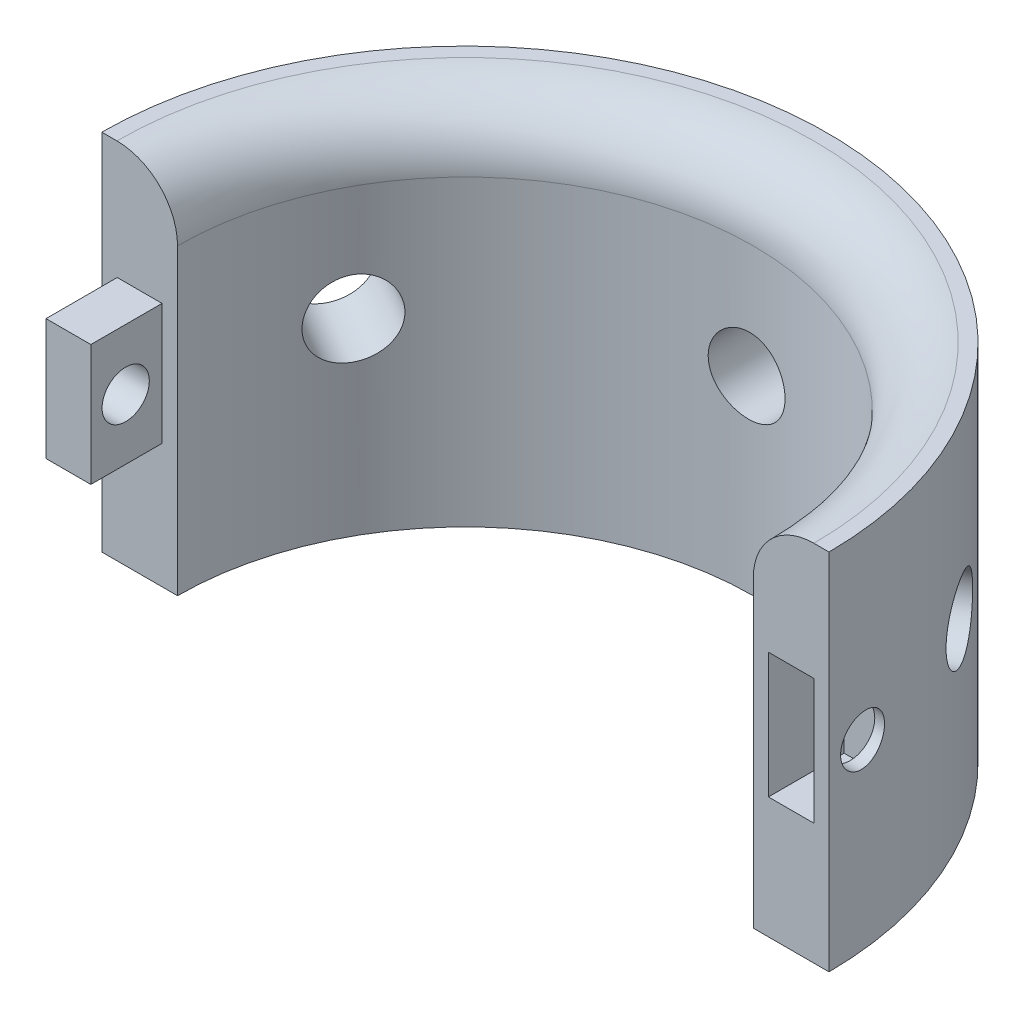
from build123d import *

# Parameters (mm, degrees)
BOSS_EXTRUDE1_DEPTH = 30.48
SKETCH3_R           = 24.13
CUT_EXTRUDE4_DEPTH  = 90.914560616
SKETCH4_R           = 3.175
CUT_EXTRUDE5_DEPTH  = 63.754
CIRPATTERN3_COUNT   = 6
SKETCH6_W           = 3.81
SKETCH6_H           = 10.509433013
CUT_EXTRUDE6_DEPTH  = 6.35
SKETCH7_W           = 3.7592
SKETCH7_H           = 10.16
BOSS_EXTRUDE4_DEPTH = 5.969
SKETCH8_R           = 1.980775352
CUT_EXTRUDE7_DEPTH  = 5.969
SKETCH9_R           = 2.056796453
CUT_EXTRUDE8_DEPTH  = 12.319
FILLET4_R           = 5.08


with BuildPart() as part:
    # Sketch1 → Boss-Extrude1 (new body)
    with BuildSketch(Plane(origin=(0, 0, 0), x_dir=(1, 0, 0), z_dir=(0, 1, 0))):
        with BuildLine():
            Line((-78.958715675, 0), (-17.998715675, 0))
            ThreePointArc((-17.998715675, 0), (-48.478715675, 30.349942827), (-78.958715675, 0))
        make_face()
    extrude(amount=BOSS_EXTRUDE1_DEPTH)

    # Sketch3 → Cut-Extrude4 (cut, through all)
    with BuildSketch(Plane(origin=(0, 0, 0), x_dir=(1, 0, 0), z_dir=(0, 1, 0))):
        with Locations((-48.478715675, 0)):
            Circle(SKETCH3_R)
    extrude(amount=CUT_EXTRUDE4_DEPTH, mode=Mode.SUBTRACT)

    # Sketch4 → Cut-Extrude5 (cut)
    with BuildSketch(Plane.XY):
        with Locations((-48.824364134, 15.798935299)):
            Circle(SKETCH4_R)
    cut_extrude5 = extrude(amount=-CUT_EXTRUDE5_DEPTH, mode=Mode.SUBTRACT)

    # CirPattern3: Cut-Extrude5 ×6 about axis
    cirpattern3_axis = Axis((-48.478715675, 30.48, 0.130335837), (0, -1, 0))
    for i in range(1, CIRPATTERN3_COUNT):
        add(cut_extrude5.rotate(cirpattern3_axis, i * 360 / CIRPATTERN3_COUNT), mode=Mode.SUBTRACT)

    # Sketch6 → Cut-Extrude6 (cut)
    with BuildSketch(Plane.XY):
        with Locations((-21.173715675, 15.414716507)):
            Rectangle(SKETCH6_W, SKETCH6_H)
    extrude(amount=-CUT_EXTRUDE6_DEPTH, mode=Mode.SUBTRACT)

    # Sketch7 → Boss-Extrude4 (add)
    with BuildSketch(Plane.XY):
        with Locations((-75.783715675, 15.494)):
            Rectangle(SKETCH7_W, SKETCH7_H)
    extrude(amount=BOSS_EXTRUDE4_DEPTH)

    # Sketch8 → Cut-Extrude7 (cut)
    with BuildSketch(Plane(origin=(-73.904115675, 0, 0), x_dir=(0, 0, -1), z_dir=(1, 0, 0))):
        with Locations((-3.048, 15.494)):
            Circle(SKETCH8_R)
    extrude(amount=-CUT_EXTRUDE7_DEPTH, mode=Mode.SUBTRACT)

    # Sketch9 → Cut-Extrude8 (cut)
    with BuildSketch(Plane(origin=(-23.078715675, 0, 0), x_dir=(0, 0, -1), z_dir=(1, 0, 0))):
        with Locations(Location((3.048, 15.24, 0), (0, 0, 180))):
            Circle(SKETCH9_R)
    extrude(amount=CUT_EXTRUDE8_DEPTH, mode=Mode.SUBTRACT)

    # Fillet4
    fillet4_edges = [part.edges().sort_by_distance(p)[0] for p in [
        (-48.478715675, 30.48, -24.13),
    ]]
    fillet(fillet4_edges, radius=FILLET4_R)


solid = part.part
